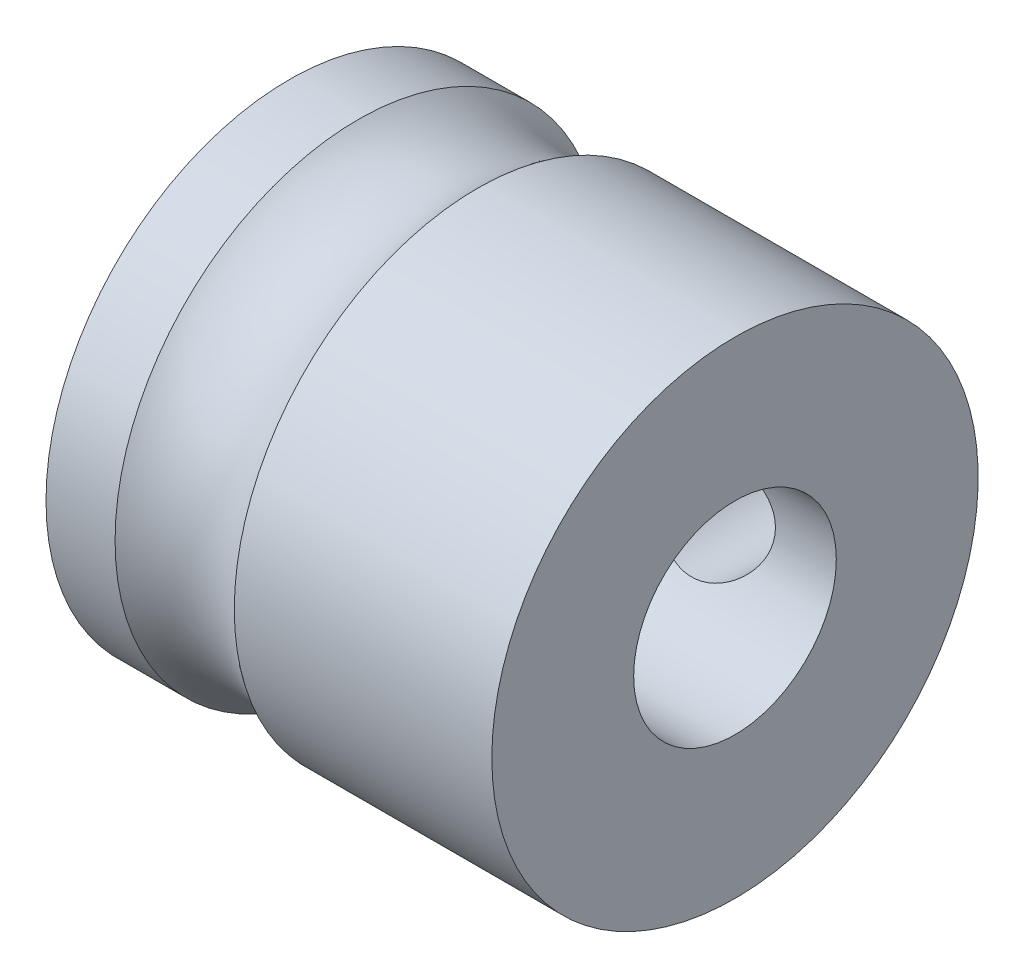
from build123d import *

# Parameters (mm, degrees)
F_5_0_5_DIAMETER_HOLE1_D      = 5
F_3_0_3_DIAMETER_HOLE1_REACH  = 17.726
F_3_0_3_DIAMETER_HOLE1_BORE_R = 1.5


with BuildPart() as part:
    # Sketch1 → Revolve1 (revolve)
    with BuildSketch(Plane(origin=(0, 0, -4.458227774), x_dir=(-1, 0, 0), z_dir=(0, 0, -1)), mode=Mode.PRIVATE) as revolve1_sk:
        with BuildLine():
            Line((-8.327233411, -26.554384432), (-8.327233411, -32.554384432))
            Line((-8.327233411, -32.554384432), (2.672766589, -32.554384432))
            Line((2.672766589, -32.554384432), (2.672766589, -26.554384432))
            Line((2.672766589, -26.554384432), (0.968480701, -26.554384432))
            ThreePointArc((0.968480701, -26.554384432), (-0.502233411, -27.054384432), (-1.972947524, -26.554384432))
            Line((-1.972947524, -26.554384432), (-8.327233411, -26.554384432))
        make_face()
    revolve(revolve1_sk.sketch.rotate(Axis((8.327233411, -32.554384432, -4.458227774), (-1, 0, 0)), 270), axis=Axis((8.327233411, -32.554384432, -4.458227774), (-1, 0, 0)))

    # Ø5.0 (5) Diameter Hole1 (through all)
    with Locations(Plane.ZY.offset(2.672766589)):
        with Locations((-4.458227774, -32.554384432)):
            Hole(F_5_0_5_DIAMETER_HOLE1_D / 2)

    # Ø3.0 (3) Diameter Hole1 bore (on position points) → Ø3.0 (3) Diameter Hole1 (cut, up to next)
    with BuildSketch(Plane(origin=(5.327233411, -32.836401262, -10.451596318), x_dir=(0, -0.998894757378, 0.047002805043), z_dir=(0, -0.047002805043, -0.998894757378)), mode=Mode.PRIVATE) as f_3_0_3_diameter_hole1_sk1:
        Circle(F_3_0_3_DIAMETER_HOLE1_BORE_R)
    f_3_0_3_diameter_hole1_tool1 = extrude(f_3_0_3_diameter_hole1_sk1.sketch, amount=-F_3_0_3_DIAMETER_HOLE1_REACH, mode=Mode.PRIVATE) & part.part
    add(f_3_0_3_diameter_hole1_tool1.solids().sort_by_distance((5.327233, -32.836401, -10.451596))[0], mode=Mode.SUBTRACT)


solid = part.part
